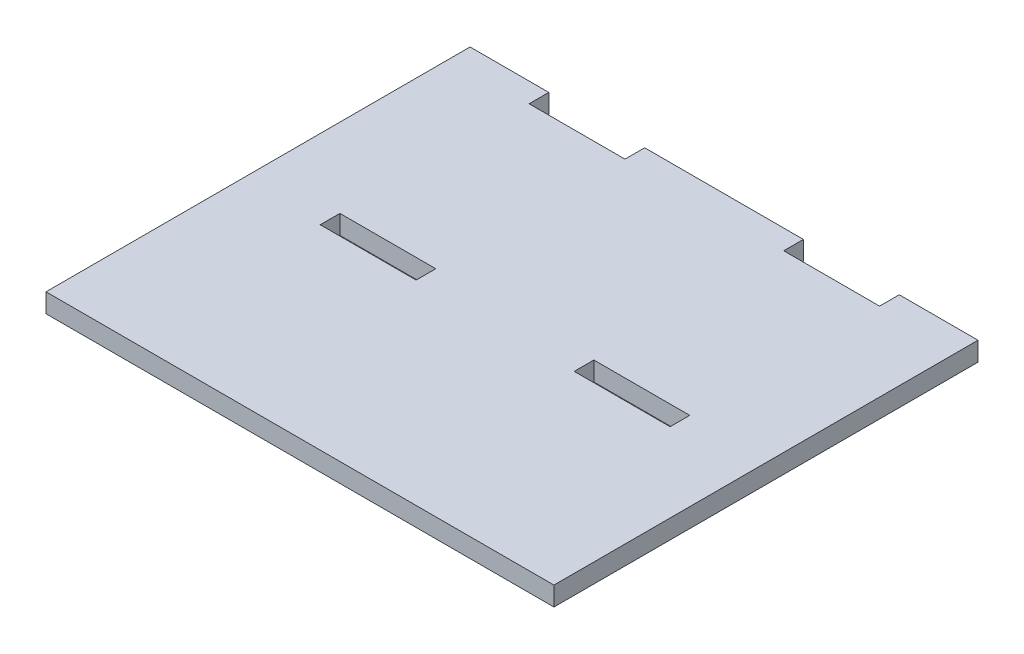
from build123d import *

# Parameters (mm, degrees)
SKETCH2_W           = 15.1
SKETCH2_H           = 3.1
BOSS_EXTRUDE5_DEPTH = 3


with BuildPart() as part:
    # Sketch2 → Boss-Extrude5 (new body)
    with BuildSketch(Plane(origin=(0, 0, 0), x_dir=(1, 0, 0), z_dir=(0, 1, 0))):
        Polygon((0, 0), (80, 0), (80, 66.79), (67.6, 66.79), (67.6, 63.69), (52.5, 63.69), (52.5, 66.79), (27.5, 66.79), (27.5, 63.69), (12.4, 63.69), (12.4, 66.79), (0, 66.79), align=None)
        with Locations((20, 32.29)):
            Rectangle(SKETCH2_W, SKETCH2_H, mode=Mode.SUBTRACT)
        with Locations((60, 32.29)):
            Rectangle(SKETCH2_W, SKETCH2_H, mode=Mode.SUBTRACT)
    extrude(amount=BOSS_EXTRUDE5_DEPTH)


solid = part.part
